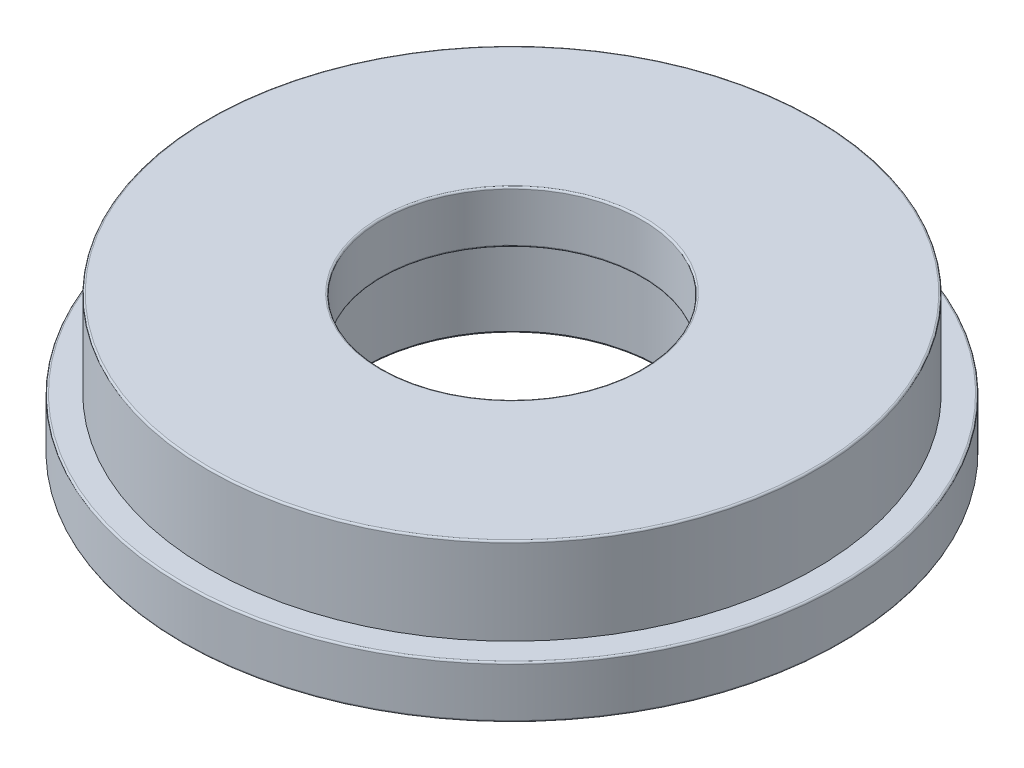
from build123d import *

# Parameters (mm, degrees)
SKETCH_1_R          = 19
EXTRUDE_1_DEPTH     = 3
SKETCH_1_3_R        = 3.05
CUT_EXTRUDE_1_DEPTH = 1.7
SKETCH_5_R          = 17.5
SKETCH_5_R_2        = 7.5
EXTRUDE_3_DEPTH     = 5
SKETCH_8_R          = 8.5
CUT_EXTRUDE_4_DEPTH = 5
FILLET_1_R          = 0.1


with BuildPart() as part:
    # 草图1 → 凸台-拉伸1 (new body)
    with BuildSketch(Plane(origin=(0, 0, 0), x_dir=(1, 0, 0), z_dir=(0, 1, 0))):
        with Locations(Location((0, 0, 0), (0, 0, 270))):
            Circle(SKETCH_1_R)
    extrude(amount=EXTRUDE_1_DEPTH)

    # 草图1<3> → 切除-拉伸1 (cut)
    with BuildSketch(Plane(origin=(0, 0, 0), x_dir=(1, 0, 0), z_dir=(0, 1, 0))):
        with Locations(Location((-12.990381057, 7.5, 0), (0, 0, 270))):
            Circle(SKETCH_1_3_R)
        with Locations(Location((-12.990381057, -7.5, 0), (0, 0, 270))):
            Circle(SKETCH_1_3_R)
        with Locations(Location((0, -15, 0), (0, 0, 270))):
            Circle(SKETCH_1_3_R)
        with Locations(Location((12.990381057, -7.5, 0), (0, 0, 270))):
            Circle(SKETCH_1_3_R)
        with Locations(Location((12.990381057, 7.5, 0), (0, 0, 270))):
            Circle(SKETCH_1_3_R)
        with Locations(Location((0, 15, 0), (0, 0, 270))):
            Circle(SKETCH_1_3_R)
    extrude(amount=CUT_EXTRUDE_1_DEPTH, mode=Mode.SUBTRACT)

    # 草图5 → 凸台-拉伸3 (add)
    with BuildSketch(Plane(origin=(0, 3, 0), x_dir=(1, 0, 0), z_dir=(0, 1, 0))):
        with Locations(Location((0, 0, 0), (0, 0, 270))):
            Circle(SKETCH_5_R)
        with Locations(Location((0, 0, 0), (0, 0, 270))):
            Circle(SKETCH_5_R_2, mode=Mode.SUBTRACT)
    extrude(amount=EXTRUDE_3_DEPTH)

    # 草图8 → 切除-拉伸4 (cut)
    with BuildSketch(Plane.XZ):
        with Locations(Location((0, 0, 0), (0, 0, 270))):
            Circle(SKETCH_8_R)
    extrude(amount=-CUT_EXTRUDE_4_DEPTH, mode=Mode.SUBTRACT)

    # 圆角1
    fillet_1_edges = [part.edges().sort_by_distance(p)[0] for p in [
        (0, 0, -18.05),
        (12.990381057, 0, -10.55),
        (12.990381057, 0, 4.45),
        (0, 0, 11.95),
        (-12.990381057, 0, 4.45),
        (-12.990381057, 0, -10.55),
        (0, 0, -19),
        (0, 8, -17.5),
        (0, 8, -7.5),
        (0, 5, -7.5),
        (0, 0, 8.5),
        (0, 3, -19),
    ]]
    fillet(fillet_1_edges, radius=FILLET_1_R)


solid = part.part
